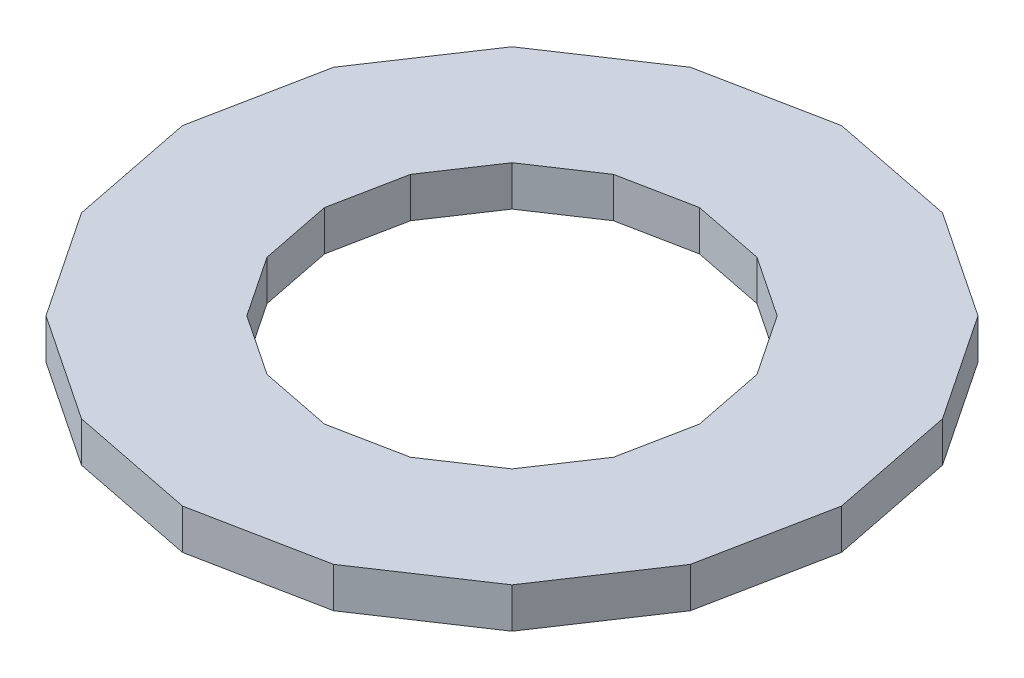
from build123d import *

# Parameters (mm, degrees)
BOSS_EXTRUDE1_DEPTH = 19.05


with BuildPart() as part:
    # Sketch1 → Boss-Extrude1 (new body)
    with BuildSketch(Plane(origin=(0, 0, 0), x_dir=(1, 0, 0), z_dir=(0, 1, 0))):
        Polygon((156.235325694, 0), (144.342619664, 59.788670693), (110.475058259, 110.475058259), (59.788670693, 144.342619664), (0, 156.235325694), (-59.788670693, 144.342619664), (-110.475058259, 110.475058259), (-144.342619664, 59.788670693), (-156.235325694, 0), (-144.342619664, -59.788670693), (-110.475058259, -110.475058259), (-59.788670693, -144.342619664), (0, -156.235325694), (59.788670693, -144.342619664), (110.475058259, -110.475058259), (144.342619664, -59.788670693), align=None)
        Polygon((88.901525606, 0), (82.134299917, 34.021140961), (62.862871614, 62.862871614), (34.021140961, 82.134299917), (0, 88.901525606), (-34.021140961, 82.134299917), (-62.862871614, 62.862871614), (-82.134299917, 34.021140961), (-88.901525606, 0), (-82.134299917, -34.021140961), (-62.862871614, -62.862871614), (-34.021140961, -82.134299917), (0, -88.901525606), (34.021140961, -82.134299917), (62.862871614, -62.862871614), (82.134299917, -34.021140961), align=None, mode=Mode.SUBTRACT)
    extrude(amount=BOSS_EXTRUDE1_DEPTH)


solid = part.part
